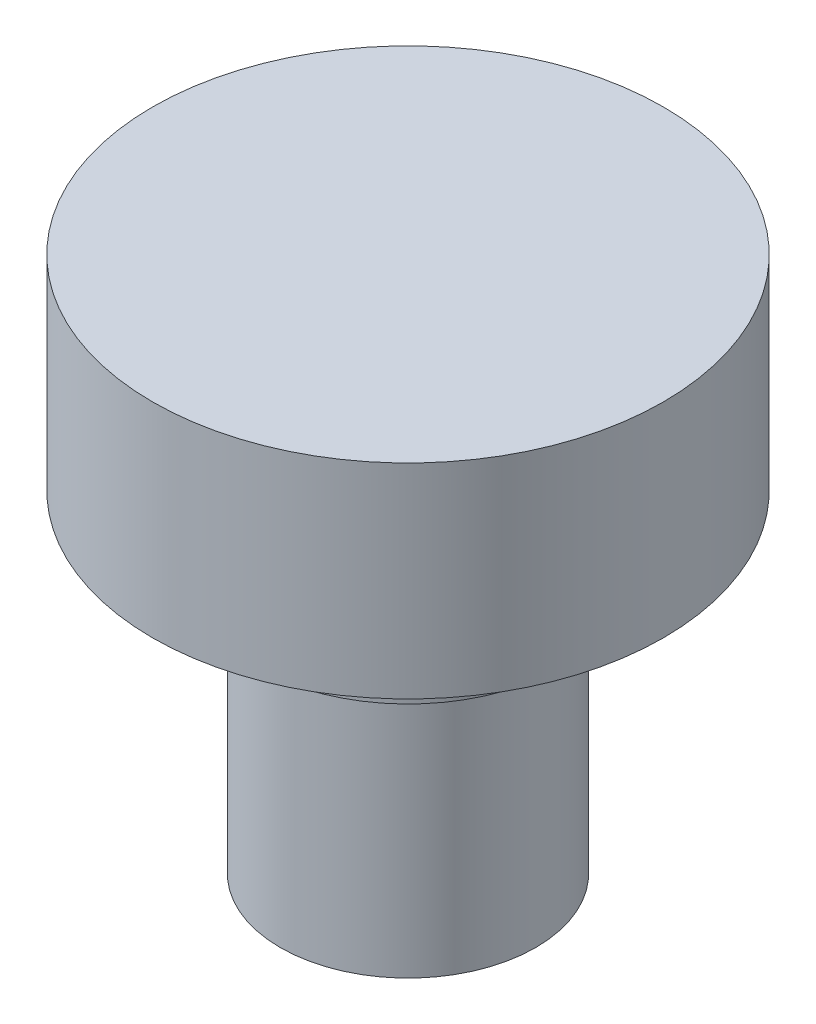
from build123d import *

# Parameters (mm, degrees)
ESBO_O1_R                = 5
RESSALTO_EXTRUS_O1_DEPTH = 4
ESBO_O4_R                = 2.5
RESSALTO_EXTRUS_O2_DEPTH = 6.5
ESBO_O5_R                = 3
RESSALTO_EXTRUS_O4_DEPTH = 1.5


with BuildPart() as part:
    # Esboço1 → Ressalto-extrusão1 (new body)
    with BuildSketch(Plane(origin=(0, 0, 0), x_dir=(1, 0, 0), z_dir=(0, 1, 0))):
        with Locations(Location((0, 0, 0), (0, 0, 270))):
            Circle(ESBO_O1_R)
    extrude(amount=RESSALTO_EXTRUS_O1_DEPTH)

    # Esboço4 → Ressalto-extrusão2 (add)
    with BuildSketch(Plane(origin=(0, 0, 0), x_dir=(-1, 0, 0), z_dir=(0, -1, 0))):
        with Locations(Location((0, 0, 0), (0, 0, 270))):
            Circle(ESBO_O4_R)
    extrude(amount=RESSALTO_EXTRUS_O2_DEPTH)

    # Esboço5 → Ressalto-extrusão4 (add)
    with BuildSketch(Plane.XZ):
        with Locations(Location((0, 0, 0), (0, 0, 90))):
            Circle(ESBO_O5_R)
    extrude(amount=RESSALTO_EXTRUS_O4_DEPTH)

    # Esboço7 → Broca de rosquear para tarraxa de M31 (revolve, cut)
    with BuildSketch(Plane(origin=(0, -6.5, 0), x_dir=(0, 0, -1), z_dir=(1, 0, 0))):
        Polygon((0, 0), (0, 8.751075774), (1.25, 8), (1.25, 0), align=None)
    revolve(axis=Axis((0, -12.85, 0), (0, 1, 0)), mode=Mode.SUBTRACT)


solid = part.part
